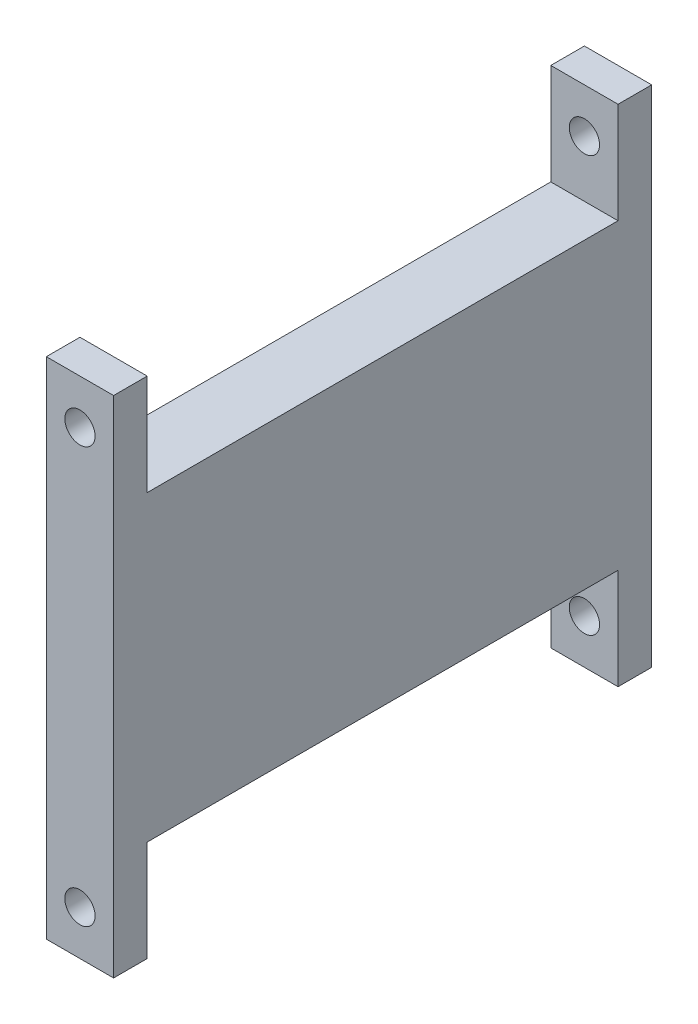
from build123d import *

# Parameters (mm, degrees)
SKETCH_1_W          = 8
SKETCH_1_H          = 60
SKETCH_1_R          = 1.8
EXTRUDE_1_DEPTH     = 32
SKETCH_2_W          = 56
SKETCH_2_H          = 12
CUT_EXTRUDE_1_DEPTH = 30


with BuildPart() as part:
    # 草图1 → 凸台-拉伸1 (new, symmetric)
    with BuildSketch(Plane.XY):
        Rectangle(SKETCH_1_W, SKETCH_1_H)
        with Locations((0, 24.71)):
            Circle(SKETCH_1_R, mode=Mode.SUBTRACT)
        with Locations((0, -24.71)):
            Circle(SKETCH_1_R, mode=Mode.SUBTRACT)
    extrude(amount=EXTRUDE_1_DEPTH, both=True)

    # 草图2 → 切除-拉伸1 (cut)
    with BuildSketch(Plane.ZY.offset(4)):
        with Locations((0, 24)):
            Rectangle(SKETCH_2_W, SKETCH_2_H)
        with Locations((0, -24)):
            Rectangle(SKETCH_2_W, SKETCH_2_H)
    extrude(amount=-CUT_EXTRUDE_1_DEPTH, mode=Mode.SUBTRACT)


solid = part.part
